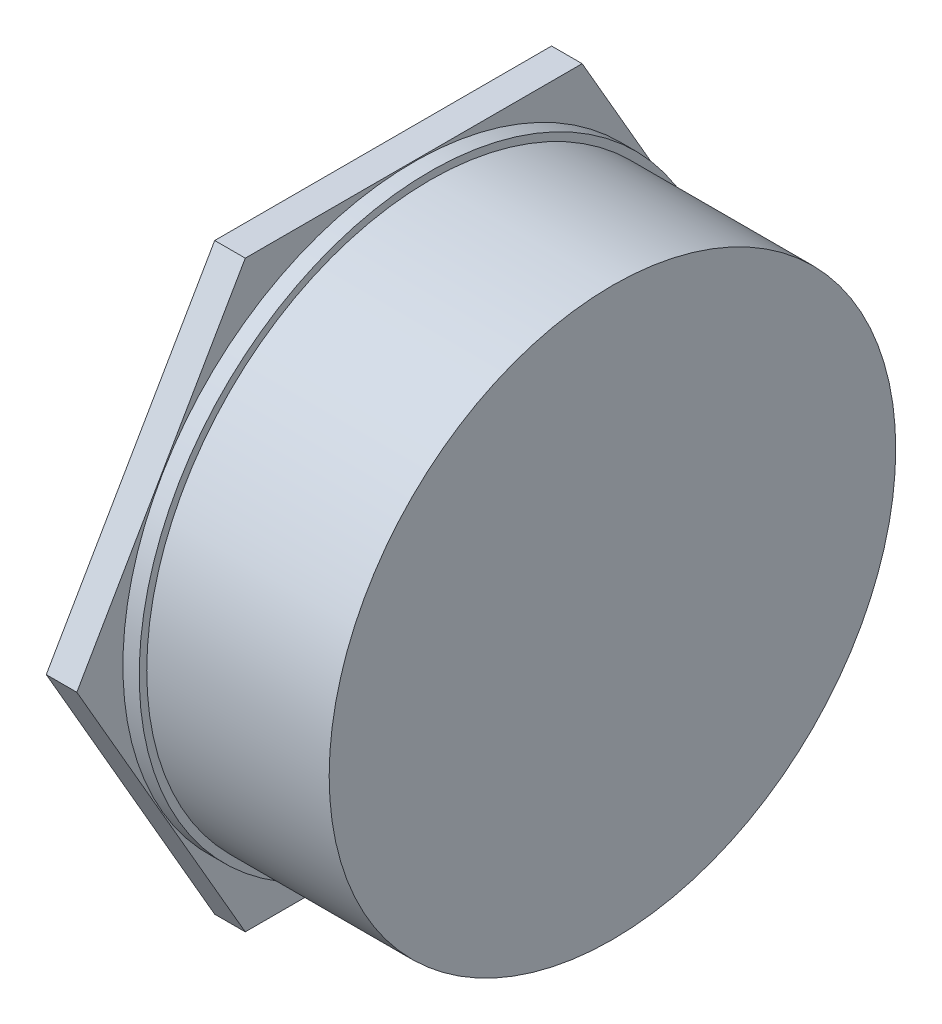
from build123d import *

# Parameters (mm, degrees)
BOSS_EXTRUDE1_DEPTH = 6
SKETCH2_R           = 57.07
BOSS_EXTRUDE2_DEPTH = 39
CUT_EXTRUDE1_START  = -35.8
SKETCH3_R           = 57.07
SKETCH3_R_2         = 55.591
CUT_EXTRUDE1_DEPTH  = 35.8


with BuildPart() as part:
    # Sketch1 → Boss-Extrude1 (new body)
    with BuildSketch(Plane(origin=(0, 0, 0), x_dir=(0, 0, -1), z_dir=(1, 0, 0))):
        Polygon((33.053302911, 57.25), (-33.053302911, 57.25), (-66.106605822, 0), (-33.053302911, -57.25), (33.053302911, -57.25), (66.106605822, 0), align=None)
    extrude(amount=BOSS_EXTRUDE1_DEPTH)

    # Sketch2 → Boss-Extrude2 (add)
    with BuildSketch(Plane(origin=(6, 0, 0), x_dir=(0, 0, -1), z_dir=(1, 0, 0))):
        Circle(SKETCH2_R)
    extrude(amount=BOSS_EXTRUDE2_DEPTH)

    # Sketch3 → Cut-Extrude1 (cut)
    with BuildSketch(Plane(origin=(45, 0, 0), x_dir=(0, 0, -1), z_dir=(1, 0, 0)).offset(CUT_EXTRUDE1_START)):
        Circle(SKETCH3_R)
        Circle(SKETCH3_R_2, mode=Mode.SUBTRACT)
    extrude(amount=CUT_EXTRUDE1_DEPTH, mode=Mode.SUBTRACT)


solid = part.part
